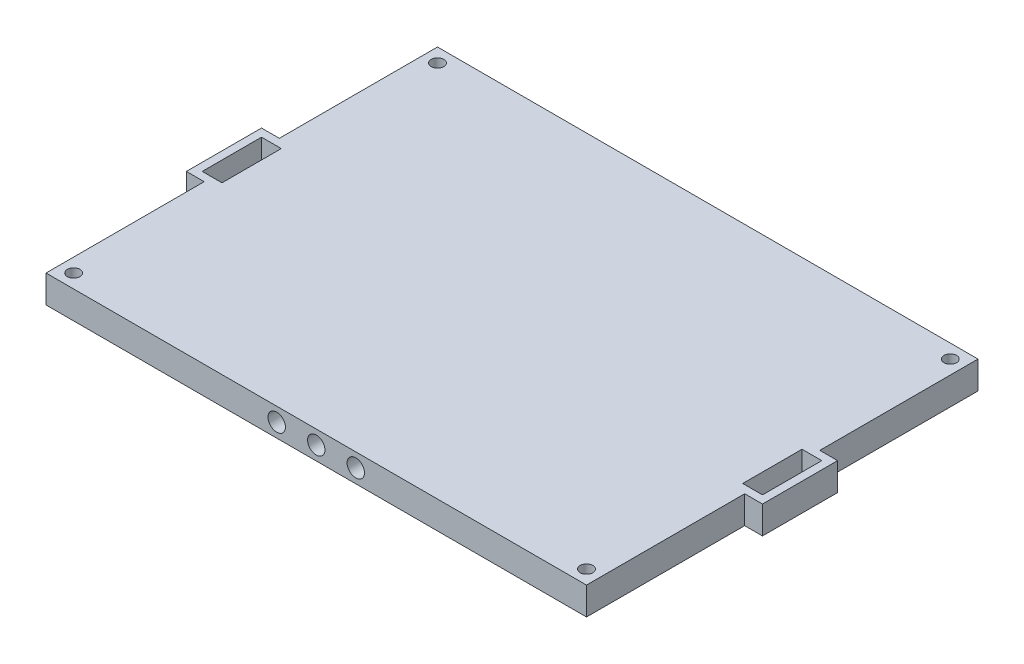
from build123d import *

# Parameters (mm, degrees)
SKETCH1_W           = 5
SKETCH1_H           = 15
BOSS_EXTRUDE1_DEPTH = 7
CUT_EXTRUDE3_REACH  = 90.347
SKETCH3_R           = 1.6
SKETCH3_4_R         = 2.2
CUT_EXTRUDE4_DEPTH  = 4
SKETCH4_R           = 2.2
CUT_EXTRUDE5_DEPTH  = 4


with BuildPart() as part:
    # Sketch1 → Boss-Extrude1 (new body)
    with BuildSketch(Plane(origin=(0, 0, 0), x_dir=(1, 0, 0), z_dir=(0, 1, 0))):
        Polygon((-68.342017383, -9.5), (-68.342017383, -49.5), (68.342017383, -49.5), (68.342017383, -9.5), (72.842017383, -9.5), (72.842017383, 9.5), (68.342017383, 9.5), (68.342017383, 49.5), (-68.342017383, 49.5), (-68.342017383, 9.5), (-72.842017383, 9.5), (-72.842017383, -9.5), align=None)
        with Locations((-68.342017383, 0)):
            Rectangle(SKETCH1_W, SKETCH1_H, mode=Mode.SUBTRACT)
        with Locations((68.342017383, 0)):
            Rectangle(SKETCH1_W, SKETCH1_H, mode=Mode.SUBTRACT)
    extrude(amount=BOSS_EXTRUDE1_DEPTH)

    # Sketch3 → Cut-Extrude3 (cut, up to next)
    with BuildSketch(Plane(origin=(0, 0, 0), x_dir=(1, 0, 0), z_dir=(0, 1, 0)), mode=Mode.PRIVATE) as cut_extrude3_sk1:
        with Locations((64.842017383, -46)):
            Circle(SKETCH3_R)
    cut_extrude3_tool1 = extrude(cut_extrude3_sk1.sketch, amount=CUT_EXTRUDE3_REACH, mode=Mode.PRIVATE) & part.part
    # Sketch3 → Cut-Extrude3 (cut, up to next)
    with BuildSketch(Plane(origin=(0, 0, 0), x_dir=(1, 0, 0), z_dir=(0, 1, 0)), mode=Mode.PRIVATE) as cut_extrude3_sk2:
        with Locations((64.842017383, 46)):
            Circle(SKETCH3_R)
    cut_extrude3_tool2 = extrude(cut_extrude3_sk2.sketch, amount=CUT_EXTRUDE3_REACH, mode=Mode.PRIVATE) & part.part
    # Sketch3 → Cut-Extrude3 (cut, up to next)
    with BuildSketch(Plane(origin=(0, 0, 0), x_dir=(1, 0, 0), z_dir=(0, 1, 0)), mode=Mode.PRIVATE) as cut_extrude3_sk3:
        with Locations((-64.842017383, 46)):
            Circle(SKETCH3_R)
    cut_extrude3_tool3 = extrude(cut_extrude3_sk3.sketch, amount=CUT_EXTRUDE3_REACH, mode=Mode.PRIVATE) & part.part
    # Sketch3 → Cut-Extrude3 (cut, up to next)
    with BuildSketch(Plane(origin=(0, 0, 0), x_dir=(1, 0, 0), z_dir=(0, 1, 0)), mode=Mode.PRIVATE) as cut_extrude3_sk4:
        with Locations((-64.842017383, -46)):
            Circle(SKETCH3_R)
    cut_extrude3_tool4 = extrude(cut_extrude3_sk4.sketch, amount=CUT_EXTRUDE3_REACH, mode=Mode.PRIVATE) & part.part
    add(cut_extrude3_tool1.solids().sort_by_distance((64.842017, 0, 46))[0], mode=Mode.SUBTRACT)
    add(cut_extrude3_tool2.solids().sort_by_distance((64.842017, 0, -46))[0], mode=Mode.SUBTRACT)
    add(cut_extrude3_tool3.solids().sort_by_distance((-64.842017, 0, -46))[0], mode=Mode.SUBTRACT)
    add(cut_extrude3_tool4.solids().sort_by_distance((-64.842017, 0, 46))[0], mode=Mode.SUBTRACT)

    # Sketch3<4> → Cut-Extrude4 (cut)
    with BuildSketch(Plane(origin=(0, 0, 0), x_dir=(1, 0, 0), z_dir=(0, 1, 0))):
        with Locations((-37.5, 37.5)):
            Circle(SKETCH3_4_R)
        with Locations((37.5, 37.5)):
            Circle(SKETCH3_4_R)
        with Locations((37.5, -37.5)):
            Circle(SKETCH3_4_R)
        with Locations((-37.5, -37.5)):
            Circle(SKETCH3_4_R)
    extrude(amount=CUT_EXTRUDE4_DEPTH, mode=Mode.SUBTRACT)

    # Sketch4 → Cut-Extrude5 (cut)
    with BuildSketch(Plane.XY.offset(49.5)):
        with Locations((0, 3.5)):
            Circle(SKETCH4_R)
        with Locations((10, 3.5)):
            Circle(SKETCH4_R)
        with Locations((-10, 3.5)):
            Circle(SKETCH4_R)
    extrude(amount=-CUT_EXTRUDE5_DEPTH, mode=Mode.SUBTRACT)


solid = part.part
